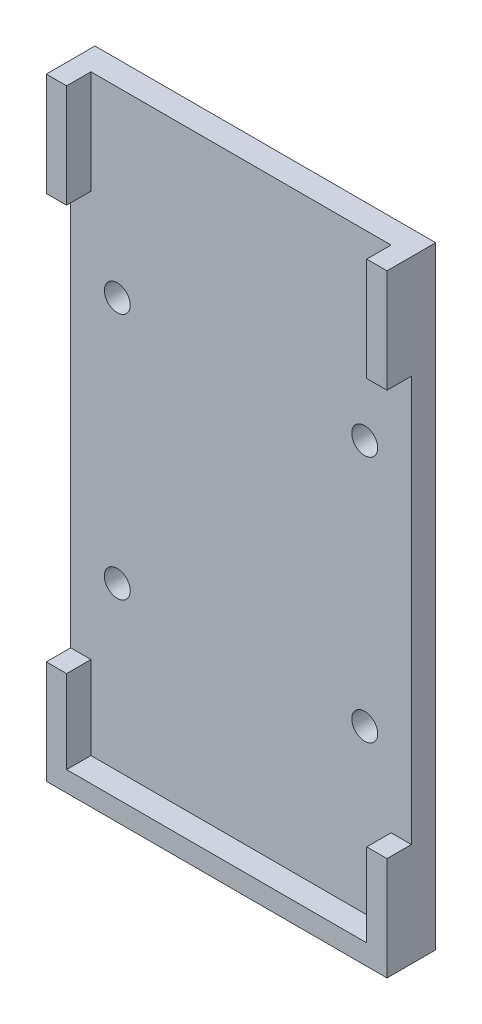
from build123d import *

# Parameters (mm, degrees)
EXTRUDE_THIN1_DEPTH        = 3
SKETCH2_W                  = 42
SKETCH2_H                  = 75.5
BOSS_EXTRUDE2_DEPTH        = 3
F_3_2_3_2_DIAMETER_HOLE1_D = 3.2
SKETCH6_W                  = 2.5
SKETCH6_H                  = 50
CUT_EXTRUDE1_DEPTH         = 3


with BuildPart() as part:
    # Sketch1 → Extrude-Thin1 (new body)
    with BuildSketch(Plane.XY):
        Polygon((0, 73), (0, 0), (37, 0), (37, 73), (39.5, 73), (39.5, -2.5), (-2.5, -2.5), (-2.5, 73), align=None)
    extrude(amount=EXTRUDE_THIN1_DEPTH)

    # Sketch2 → Boss-Extrude2 (add)
    with BuildSketch(Plane(origin=(0, 0, 0), x_dir=(-1, 0, 0), z_dir=(0, 0, -1))):
        with Locations((-18.5, 35.25)):
            Rectangle(SKETCH2_W, SKETCH2_H)
    extrude(amount=BOSS_EXTRUDE2_DEPTH)

    # Ø3.2 (3.2) Diameter Hole1 (through all)
    with Locations(Plane.XY):
        with Locations((3.25, 50.5), (33.75, 50.5), (33.75, 20), (3.25, 20)):
            Hole(F_3_2_3_2_DIAMETER_HOLE1_D / 2)

    # Sketch6 → Cut-Extrude1 (cut)
    with BuildSketch(Plane.XY.offset(3)):
        with Locations((-1.25, 35.25)):
            Rectangle(SKETCH6_W, SKETCH6_H)
    cut_extrude1 = extrude(amount=-CUT_EXTRUDE1_DEPTH, mode=Mode.SUBTRACT)

    # Mirror1: Cut-Extrude1 across plane
    add(cut_extrude1.mirror(Plane(origin=(18.5, 0, 0), x_dir=(0, 0, 1), z_dir=(1, 0, 0))), mode=Mode.SUBTRACT)


solid = part.part
